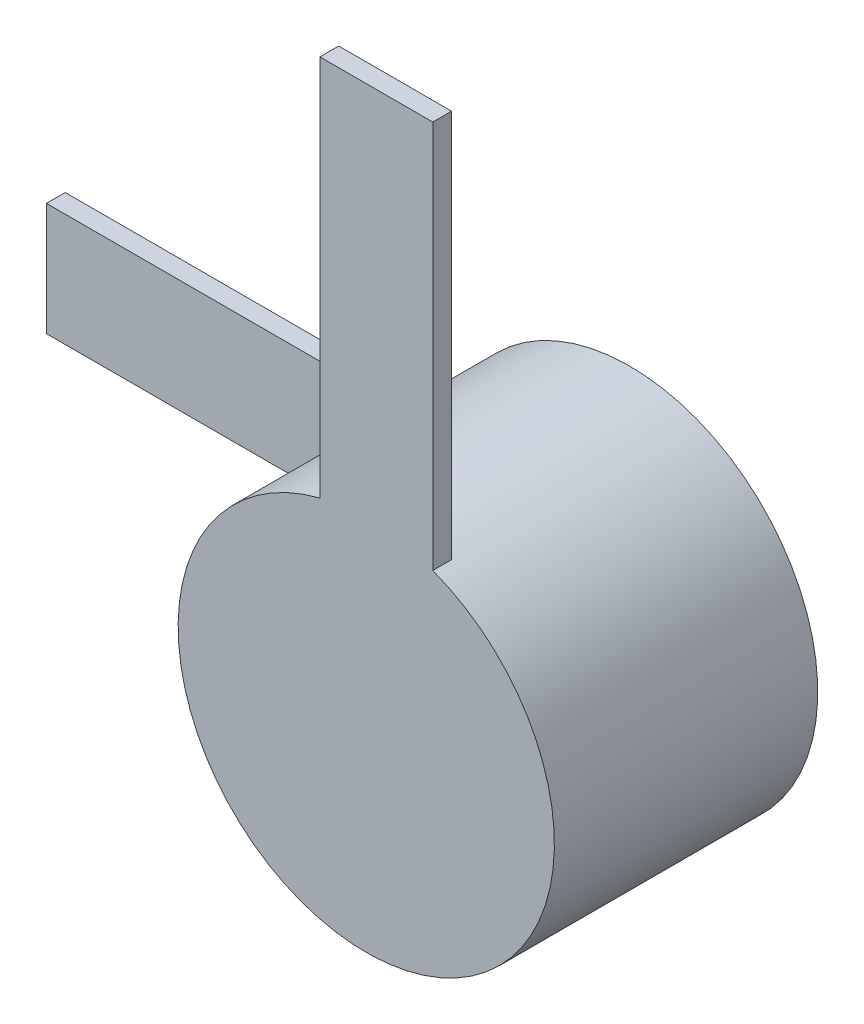
from build123d import *

# Parameters (mm, degrees)
SKETCH1_R           = 50
BOSS_EXTRUDE1_DEPTH = 70
SKETCH2_W           = 30
SKETCH2_H           = 5
BOSS_EXTRUDE2_DEPTH = 150
SKETCH4_W           = 5
SKETCH4_H           = 30
BOSS_EXTRUDE3_DEPTH = 150


with BuildPart() as part:
    # Sketch1 → Boss-Extrude1 (new body)
    with BuildSketch(Plane.XY):
        Circle(SKETCH1_R)
    extrude(amount=BOSS_EXTRUDE1_DEPTH)

    # Sketch2 → Boss-Extrude2 (add)
    with BuildSketch(Plane(origin=(0, 0, 0), x_dir=(1, 0, 0), z_dir=(0, 1, 0))):
        with Locations((2.673304283, -67.5)):
            Rectangle(SKETCH2_W, SKETCH2_H)
    extrude(amount=BOSS_EXTRUDE2_DEPTH)

    # Sketch4 → Boss-Extrude3 (add)
    with BuildSketch(Plane(origin=(0, 0, 0), x_dir=(0, 0, -1), z_dir=(1, 0, 0))):
        with Locations((-2.5, -0.059930336)):
            Rectangle(SKETCH4_W, SKETCH4_H)
    extrude(amount=-BOSS_EXTRUDE3_DEPTH)


solid = part.part
